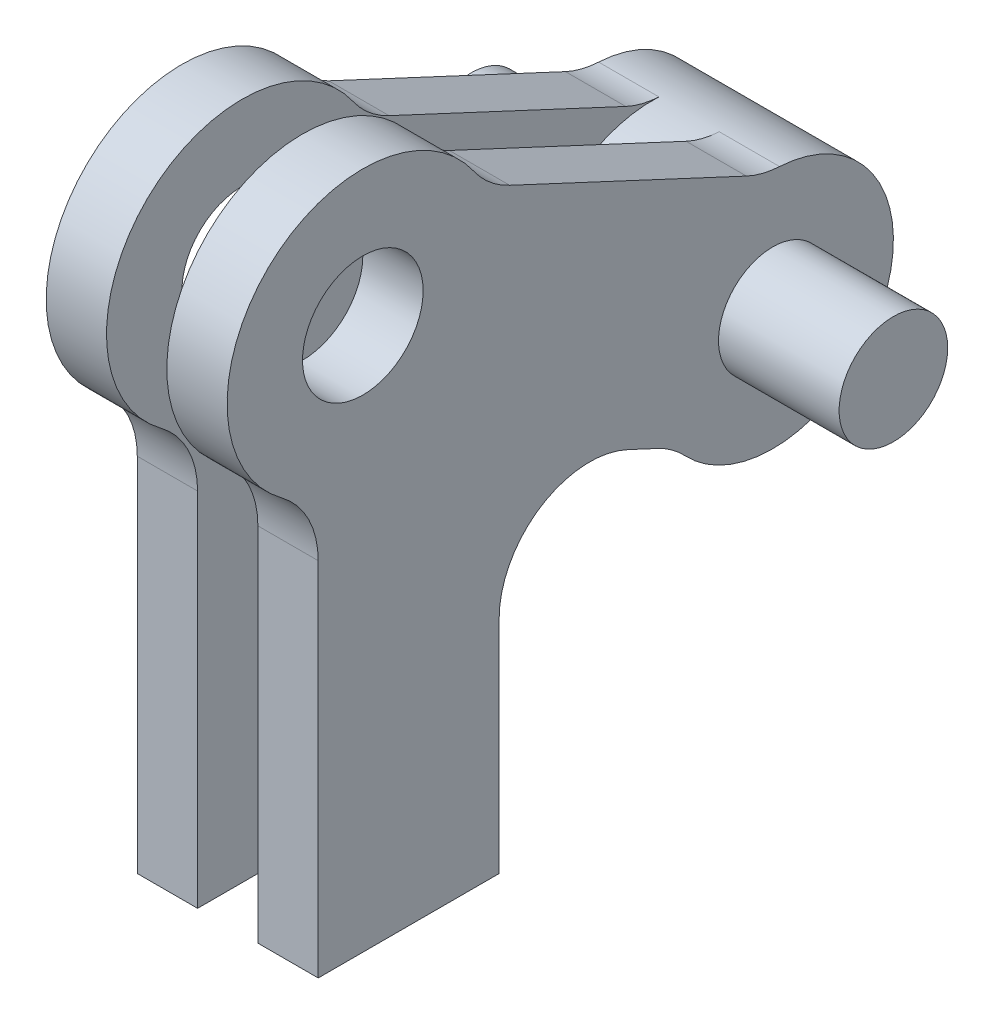
from build123d import *
from build123d.topology import SkipClean

# Parameters (mm, degrees)
EXTRUDE_1_DEPTH          = 2
CUT_EXTRUDE_3_DEPTH      = 26.250159217995726
CUT_EXTRUDE_3_DEPTH_BACK = 26.250159217995726
SKETCH_1_3_R             = 2
SKETCH_1_3_R_2           = 1.9999999999999996
FILLET_1_R               = 3
EXTRUDE_START            = -1
EXTRUDE_2_DEPTH          = 1
SKETCH_2_R               = 1.9999999999999996
EXTRUDE_3_DEPTH          = 6
SKETCH_2_3_R             = 1.7999999999999992
EXTRUDE_4_DEPTH          = 4
EXTRUDE_START_2          = -10
SKETCH_2_4_R             = 1.7999999999999992
EXTRUDE_5_DEPTH          = 4


with BuildPart() as part:
    # 草图1 → 凸台-拉伸1 (new body)
    with BuildSketch(Plane(origin=(0, 0, 0), x_dir=(0, 0, -1), z_dir=(1, 0, 0))):
        with BuildLine():
            Line((1.4791639160924377, 3.172077254628277), (-1.4791639160924381, -3.172077254628276))
            Line((-1.4791639160924381, -3.172077254628276), (3.1918530496674338, -3.172077254628276))
            ThreePointArc((3.1918530496673796, -3.172077254628116), (4.160128527071201, -1.7156137788699422), (4.5, -1.1e-15))
            ThreePointArc((4.5, 0), (4.384156275694355, 1.0144820108261179), (4.042589444315643, 1.9767322997077126))
            Line((4.042589444315688, 1.9767322997077619), (1.4791639160924377, 3.172077254628277))
        make_face()
        with BuildLine():
            Line((1.0842616121308644, -4.367422209548816), (-1.4791639160924381, -3.172077254628276))
            Line((-1.4791639160924381, -3.172077254628276), (-1.479163916092438, -4.249949894919907))
            ThreePointArc((-1.4791639160925047, -4.249949894919926), (-0.20600216890754225, -4.495282316652135), (1.0842616121308772, -4.367422209548712))
        make_face()
        with BuildLine():
            Line((3.1918530496674338, -3.172077254628276), (-1.4791639160924381, -3.172077254628276))
            Line((-1.4791639160924381, -3.172077254628276), (1.0842616121308644, -4.367422209548816))
            ThreePointArc((1.0842616121308772, -4.367422209548712), (2.220022869369828, -3.914268572731687), (3.1918530496673796, -3.172077254628116))
        make_face()
        with BuildLine():
            Line((-1.479163916092438, -4.249949894919907), (-1.4791639160924381, -3.172077254628276))
            Line((-1.4791639160924381, -3.172077254628276), (1.4791639160924377, 3.172077254628277))
            Line((1.4791639160924377, 3.172077254628277), (4.042589444315688, 1.9767322997077619))
            ThreePointArc((4.042589444315643, 1.9767322997077126), (-3.3668502191083185, 2.9856857842194757), (-1.4791639160925047, -4.249949894919926))
        make_face()
        with BuildLine():
            ThreePointArc((4.5, -1.1e-15), (4.160128527071201, -1.7156137788699422), (3.1918530496673796, -3.172077254628116))
            Line((3.1918530496674338, -3.172077254628276), (4.520836083907562, -3.172077254628276))
            Line((4.520836083907562, -3.172077254628276), (4.520836083907562, -5.969923203558247))
            Line((4.520836083907563, -5.969923203558248), (10.360395406591675, -8.692954435976247))
            ThreePointArc((10.360395406591717, -8.69295443597619), (9.969385657403148, -4.6488008791476965), (13.318723238776467, -2.3487999267197663))
            Line((13.318723238776487, -2.348799926719662), (4.042589444315688, 1.9767322997077619))
            ThreePointArc((4.042589444315643, 1.9767322997077126), (4.384156275694355, 1.0144820108261179), (4.5, 0))
        make_face()
        with BuildLine():
            Line((4.520836083907562, -3.172077254628276), (3.1918530496674338, -3.172077254628276))
            ThreePointArc((3.1918530496673796, -3.172077254628116), (2.220022869369828, -3.914268572731687), (1.0842616121308772, -4.367422209548712))
            Line((1.0842616121308644, -4.367422209548816), (4.520836083907563, -5.969923203558248))
            Line((4.520836083907562, -5.969923203558247), (4.520836083907562, -3.172077254628276))
        make_face()
        with BuildLine():
            ThreePointArc((1.0842616121308772, -4.367422209548712), (-0.20600216890754225, -4.495282316652135), (-1.4791639160925047, -4.249949894919926))
            Line((-1.479163916092438, -4.249949894919907), (-1.4791639160924364, -18))
            Line((-1.4791639160924364, -18), (4.520836083907564, -18.000000000000004))
            Line((4.520836083907564, -18.000000000000004), (4.520836083907562, -5.969923203558247))
            Line((4.520836083907563, -5.969923203558248), (1.0842616121308644, -4.367422209548816))
        make_face()
        with BuildLine():
            ThreePointArc((17.59461680554977, -6.3392739261104545), (16.323758221169964, -3.4149300452464746), (13.318723238776467, -2.3487999267197663))
            Line((13.318723238776487, -2.348799926719663), (15.073780721642205, -3.1671966714821758))
            Line((15.073780721642205, -3.167196671482176), (12.115452889457329, -9.51135118073873))
            Line((12.115452889457327, -9.51135118073873), (10.360395406591675, -8.692954435976247))
            ThreePointArc((10.360395406591717, -8.69295443597619), (14.832177794787833, -10.143014558424401), (17.59461680554977, -6.339273926110455))
        make_face()
        with BuildLine():
            Line((15.073780721642205, -3.1671966714821758), (13.318723238776487, -2.348799926719663))
            ThreePointArc((13.318723238776467, -2.3487999267197663), (9.969385657403148, -4.6488008791476965), (10.360395406591717, -8.69295443597619))
            Line((10.360395406591675, -8.692954435976247), (12.115452889457327, -9.51135118073873))
            Line((12.115452889457329, -9.51135118073873), (15.073780721642205, -3.167196671482176))
        make_face()
    extrude(amount=EXTRUDE_1_DEPTH)

    # 草图1<3> → 切除-拉伸3 (cut, two sides: drawn at the far end of the back side and taken through both)
    with BuildSketch(Plane(origin=(0, 0, 0), x_dir=(0, 0, -1), z_dir=(1, 0, 0)).offset(-CUT_EXTRUDE_3_DEPTH_BACK)):
        Circle(SKETCH_1_3_R)
        with Locations((13.594616805549768, -6.3392739261104545)):
            Circle(SKETCH_1_3_R_2)
    extrude(amount=CUT_EXTRUDE_3_DEPTH + CUT_EXTRUDE_3_DEPTH_BACK, mode=Mode.SUBTRACT)

    # 圆角1
    fillet_1_edges = [part.edges().sort_by_distance(p)[0] for p in [
        (1, -2.3487999267197144, -13.318723238776478),
        (1, 1.9767322997077375, -4.0425894443156665),
        (1, -8.692954435976219, -10.360395406591696),
        (1, -5.969923203558247, -4.520836083907563),
        (1, -4.249949894919917, 1.4791639160924714),
    ]]
    fillet(fillet_1_edges, radius=FILLET_1_R)

    # 草图1<4> → 凸台-拉伸2 (add)
    with SkipClean():  # the faces are left unmerged after this step: merging them gives an invalid solid
        with BuildSketch(Plane(origin=(0, 0, 0), x_dir=(0, 0, -1), z_dir=(1, 0, 0)).offset(EXTRUDE_START)):
            with BuildLine():
                ThreePointArc((17.59461680554977, -6.3392739261104545), (16.323758221169964, -3.4149300452464746), (13.318723238776467, -2.3487999267197663))
                Line((13.318723238776487, -2.348799926719663), (15.073780721642205, -3.1671966714821758))
                Line((15.073780721642205, -3.167196671482176), (14.43985332903116, -4.526658352037151))
                ThreePointArc((14.439853329031175, -4.526658352037159), (15.28139969717554, -5.264674709416811), (15.594616805549768, -6.3392739261104545))
                ThreePointArc((15.594616805549768, -6.339273926110455), (14.66921602224341, -8.02605681773623), (12.749380282068358, -8.15188950018375))
                Line((12.749380282068373, -8.151889500183756), (12.115452889457329, -9.51135118073873))
                Line((12.115452889457327, -9.51135118073873), (10.360395406591675, -8.692954435976247))
                ThreePointArc((10.360395406591717, -8.69295443597619), (14.832177794787833, -10.143014558424401), (17.59461680554977, -6.339273926110455))
            make_face()
            with BuildLine():
                Line((15.073780721642205, -3.1671966714821758), (13.318723238776487, -2.348799926719663))
                ThreePointArc((13.318723238776467, -2.3487999267197663), (9.969385657403148, -4.6488008791476965), (10.360395406591717, -8.69295443597619))
                Line((10.360395406591675, -8.692954435976247), (12.115452889457327, -9.51135118073873))
                Line((12.115452889457329, -9.51135118073873), (12.749380282068373, -8.151889500183756))
                ThreePointArc((12.749380282068358, -8.15188950018375), (11.782001231476473, -5.494037402629046), (14.439853329031175, -4.526658352037159))
                Line((14.43985332903116, -4.526658352037151), (15.073780721642205, -3.167196671482176))
            make_face()
        extrude(amount=EXTRUDE_2_DEPTH)

    # 镜向1: part across plane


with BuildPart() as part_1:
    with SkipClean():  # the faces are left unmerged after this step: merging them gives an invalid solid
        add(part.part)
        add(part.part.mirror(Plane.ZY.offset(1)))

    # 草图2 → 凸台-拉伸3 (add)
    with BuildSketch(Plane(origin=(2, 0, 0), x_dir=(0, 0, -1), z_dir=(1, 0, 0))):
        with Locations((13.594616805549768, -6.3392739261104545)):
            Circle(SKETCH_2_R)
    extrude(amount=-EXTRUDE_3_DEPTH)

    # 草图2<3> → 凸台-拉伸4 (add)
    with BuildSketch(Plane(origin=(2, 0, 0), x_dir=(0, 0, -1), z_dir=(1, 0, 0))):
        with Locations((13.594616805549768, -6.3392739261104545)):
            Circle(SKETCH_2_3_R)
    extrude(amount=EXTRUDE_4_DEPTH)

    # 草图2<4> → 凸台-拉伸5 (add)
    with BuildSketch(Plane(origin=(2, 0, 0), x_dir=(0, 0, -1), z_dir=(1, 0, 0)).offset(EXTRUDE_START_2)):
        with Locations((13.594616805549768, -6.3392739261104545)):
            Circle(SKETCH_2_4_R)
    extrude(amount=EXTRUDE_5_DEPTH)


solid = part_1.part
